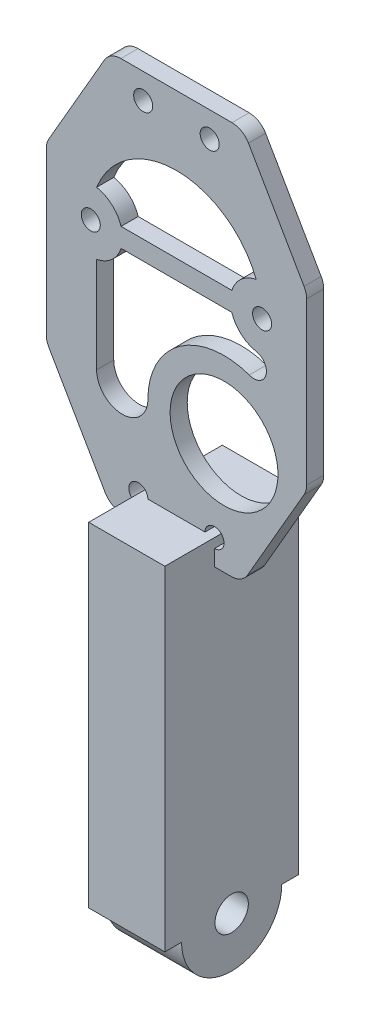
from build123d import *

# Parameters (mm, degrees)
SKETCH1_R           = 1.5
SKETCH1_R_2         = 8.5
BOSS_EXTRUDE1_DEPTH = 2.7
FILLET1_R           = 3
SCALE1_SCALE        = 1.9
BOSS_EXTRUDE2_START = -5.13
SKETCH2_W           = 22.8
SKETCH2_H           = 100
BOSS_EXTRUDE2_DEPTH = 20
SKETCH3_R           = 15
BOSS_EXTRUDE3_DEPTH = 22.8
CUT_EXTRUDE1_REACH  = 177.683
SKETCH4_R           = 5


with BuildPart() as part:
    # Sketch1 → Boss-Extrude1 (new body)
    with BuildSketch(Plane.XY):
        with BuildLine():
            Line((10.487675588, 31), (-10.487675588, 31))
            Line((-10.487675588, 31), (-20.108076211, 14.336977332))
            ThreePointArc((-20.108076211, 14.336977332), (-20.407777479, 13.613434467), (-20.51, 12.836977332))
            Line((-20.51, 12.836977332), (-20.51, -12.596152423))
            ThreePointArc((-20.51, -12.596152423), (-20.407777479, -13.372609558), (-20.108076211, -14.096152423))
            Line((-20.108076211, -14.096152423), (-10.348635262, -31))
            Line((-10.348635262, -31), (10.348635262, -31))
            Line((10.348635262, -31), (20.108076211, -14.096152423))
            ThreePointArc((20.108076211, -14.096152423), (20.407777479, -13.372609558), (20.51, -12.596152423))
            Line((20.51, -12.596152423), (20.51, 12.836977332))
            ThreePointArc((20.51, 12.836977332), (20.407777479, 13.613434467), (20.108076211, 14.336977332))
            Line((20.108076211, 14.336977332), (10.487675588, 31))
        make_face()
        with Locations(Location((-6, -27, 0), (0, 0, 180))):
            Circle(SKETCH1_R, mode=Mode.SUBTRACT)
        with Locations(Location((6, -27, 0), (0, 0, 180))):
            Circle(SKETCH1_R, mode=Mode.SUBTRACT)
        with Locations(Location((7.5, -13.4, 0), (0, 0, 180))):
            Circle(SKETCH1_R_2, mode=Mode.SUBTRACT)
        with BuildLine():
            ThreePointArc((-4.5, -13.4), (-8.54, -17.44), (-12.58, -13.4))
            Line((-12.58, -13.4), (-12.58, 1.685368783))
            ThreePointArc((-12.58, 1.685368783), (-10.18215631, 2.859423407), (-8.730303993, 5.1))
            Line((-8.730303993, 5.1), (8.729875369, 5.1))
            ThreePointArc((8.729875369, 5.1), (10.179804764, 2.860963681), (12.574584064, 1.685969643))
            ThreePointArc((12.574584064, 1.685969643), (14.121431526, -0.726790857), (11.622623122, -2.13039581))
            ThreePointArc((11.622623122, -2.13039581), (11.545720037, -2.104624526), (11.469942926, -2.075709596))
            ThreePointArc((11.469942926, -2.075709596), (0.558793877, -3.611248417), (-4.5, -13.4))
        make_face(mode=Mode.SUBTRACT)
        with Locations(Location((-13.5, 6.6, 0), (0, 0, 180))):
            Circle(SKETCH1_R, mode=Mode.SUBTRACT)
        with BuildLine():
            Line((8.729875369, 8.1), (-8.730303993, 8.1))
            ThreePointArc((-8.730303993, 8.1), (-10.179901517, 10.338575405), (-12.574074074, 11.513518208))
            ThreePointArc((-12.574074074, 11.513518208), (-0.00020804, 20.099999998), (12.57392263, 11.513905748))
            ThreePointArc((12.57392263, 11.513905748), (10.179553129, 10.338812856), (8.729875369, 8.1))
        make_face(mode=Mode.SUBTRACT)
        with Locations(Location((-5.24, 27, 0), (0, 0, 180))):
            Circle(SKETCH1_R, mode=Mode.SUBTRACT)
        with Locations(Location((13.5, 6.6, 0), (0, 0, 180))):
            Circle(SKETCH1_R, mode=Mode.SUBTRACT)
        with Locations(Location((5.24, 27, 0), (0, 0, 180))):
            Circle(SKETCH1_R, mode=Mode.SUBTRACT)
    extrude(amount=BOSS_EXTRUDE1_DEPTH)

    # Fillet1
    fillet1_edges = [part.edges().sort_by_distance(p)[0] for p in [
        (-10.487675588, 31, 1.35),
        (10.487675588, 31, 1.35),
        (10.348635262, -31, 1.35),
        (-10.348635262, -31, 1.35),
    ]]
    fillet(fillet1_edges, radius=FILLET1_R)


with BuildPart() as part_1:
    # Scale1: scaled about (-0.489793852, 0.73928426, 1.35)
    add(part.part.scale(SCALE1_SCALE).moved(Location((0.440814467, -0.665355834, -1.215))))

    # Sketch2 → Boss-Extrude2 (add, symmetric)
    with BuildSketch(Plane.XY.offset(3.915).offset(BOSS_EXTRUDE2_START)):
        with Locations((0.440814467, -101.965355834)):
            Rectangle(SKETCH2_W, SKETCH2_H)
    extrude(amount=BOSS_EXTRUDE2_DEPTH, both=True)

    # Sketch3 → Boss-Extrude3 (add)
    with BuildSketch(Plane.ZY.offset(10.959185533)):
        with Locations((-1.215, -151.965355834)):
            Circle(SKETCH3_R)
    extrude(amount=-BOSS_EXTRUDE3_DEPTH)

    # Sketch4 → Cut-Extrude1 (cut, up to next)
    with BuildSketch(Plane(origin=(11.840814467, 0, 0), x_dir=(0, 0, -1), z_dir=(1, 0, 0)), mode=Mode.PRIVATE) as cut_extrude1_sk1:
        with Locations(Location((1.215, -151.965355834, 0), (0, 0, 90))):
            Circle(SKETCH4_R)
    cut_extrude1_tool1 = extrude(cut_extrude1_sk1.sketch, amount=-CUT_EXTRUDE1_REACH, mode=Mode.PRIVATE) & part_1.part
    add(cut_extrude1_tool1.solids().sort_by_distance((11.840814, -151.965356, -1.215))[0], mode=Mode.SUBTRACT)


solid = part_1.part
